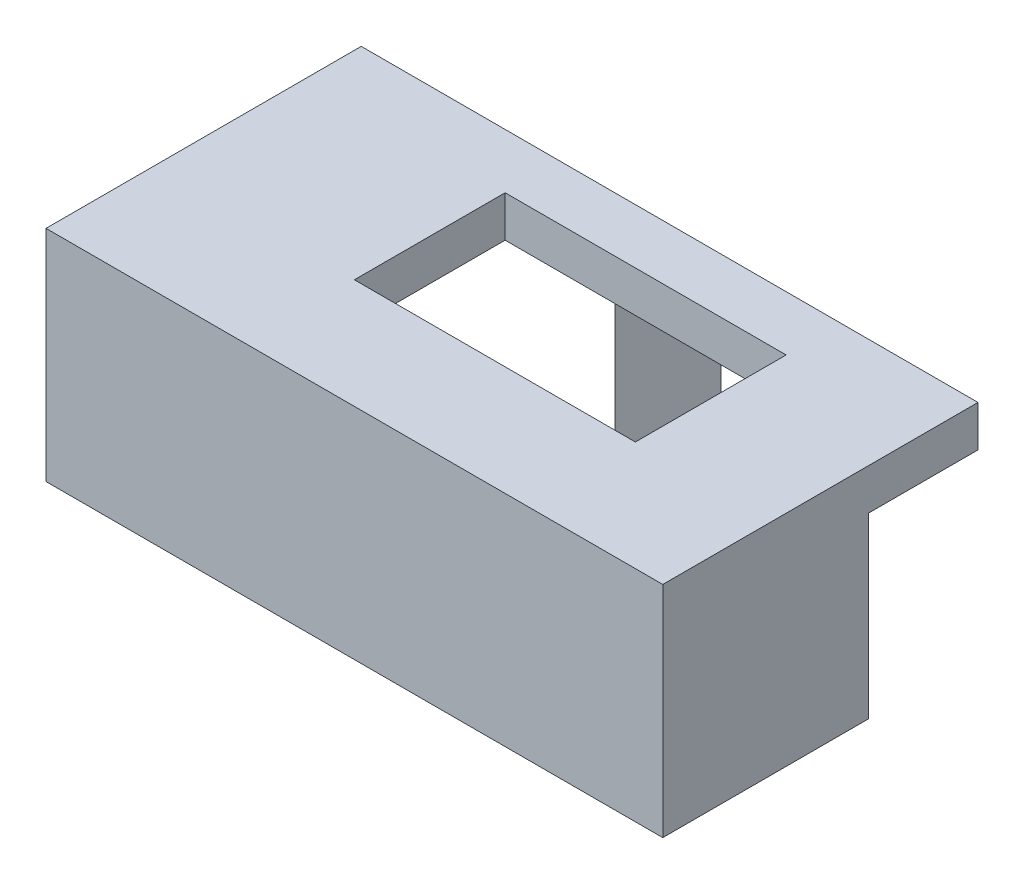
from build123d import *

# Parameters (mm, degrees)
SKETCH1_W           = 90
SKETCH1_H           = 46
SKETCH1_W_2         = 41
SKETCH1_H_2         = 22
BOSS_EXTRUDE1_DEPTH = 6
BOSS_EXTRUDE2_DEPTH = 26


with BuildPart() as part:
    # Sketch1 → Boss-Extrude1 (new body)
    with BuildSketch(Plane(origin=(0, 0, 0), x_dir=(1, 0, 0), z_dir=(0, 1, 0))):
        with Locations((45, 23)):
            Rectangle(SKETCH1_W, SKETCH1_H)
        with Locations((49.5, 27)):
            Rectangle(SKETCH1_W_2, SKETCH1_H_2, mode=Mode.SUBTRACT)
    extrude(amount=BOSS_EXTRUDE1_DEPTH)

    # Sketch2 → Boss-Extrude2 (add)
    with BuildSketch(Plane.XZ):
        Polygon((0, 0), (4, 0), (82, 0), (90, 0), (90, -30), (86, -30), (86, -2), (4, -2), (4, -30), (0, -30), align=None)
        Polygon((37.5, -46), (52.5, -46), (45, -38), align=None)
    extrude(amount=BOSS_EXTRUDE2_DEPTH)


solid = part.part
